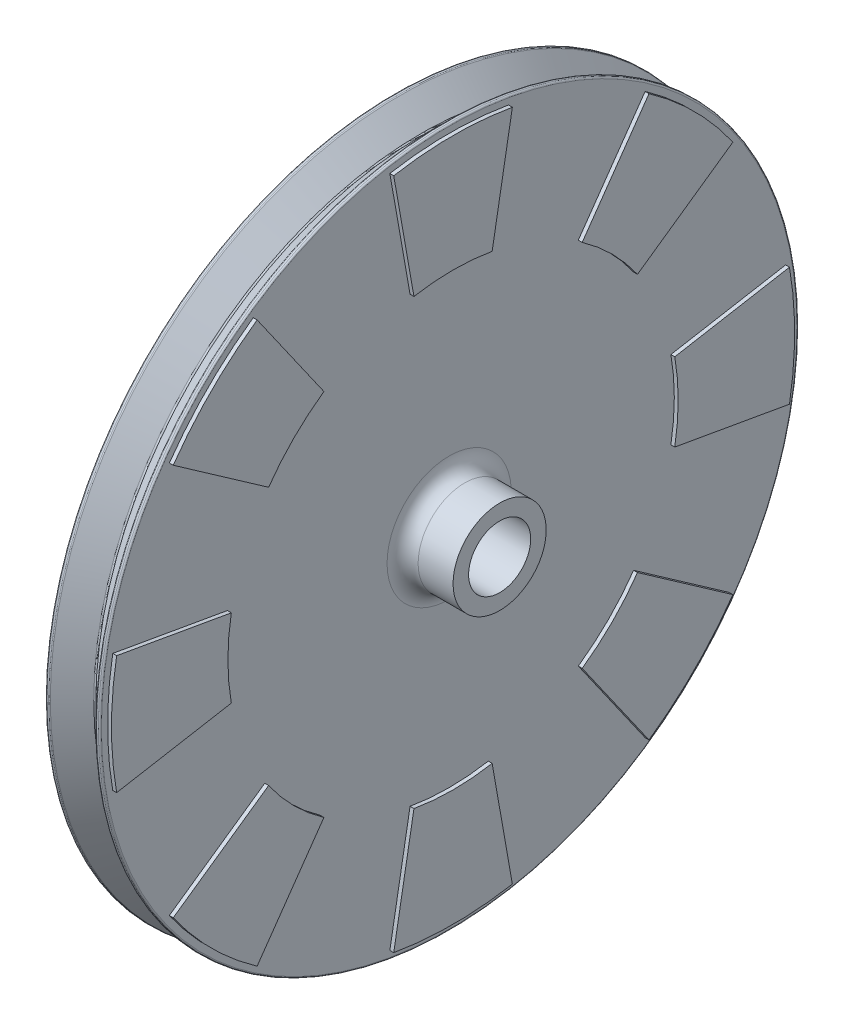
from build123d import *

# Parameters (mm, degrees)
EXTRUSION1_DEPTH             = 0.5
R_P_TITION_CIRCULAIRE1_COUNT = 8
CONG_1_R                     = 0.2
ESQUISSE3_R                  = 2.023797345
ENL_V_MAT_EXTRU_1_DEPTH      = 0.25


with BuildPart() as part:
    # Esquisse1 → Révolution2 (revolve)
    with BuildSketch(Plane.XY, mode=Mode.PRIVATE) as r_volution2_sk:
        with BuildLine():
            Line((-3, 45), (0, 42))
            Line((0, 42), (3, 45))
            Line((3, 45), (3.5, 45))
            Line((3.5, 45), (3.5, 8))
            ThreePointArc((3.5, 8), (4.085786438, 6.585786438), (5.5, 6))
            Line((5.5, 6), (10, 6))
            Line((10, 6), (10, 4))
            Line((10, 4), (0, 4))
            Line((0, 4), (0, 0))
            Line((0, 0), (-3.5, 0))
            Line((-3.5, 0), (-3.5, 45))
            Line((-3.5, 45), (-3, 45))
        make_face()
    revolve(r_volution2_sk.sketch.rotate(Axis((0, 0, 0), (1, 0, 0)), 90), axis=Axis((0, 0, 0), (1, 0, 0)))

    # Esquisse2 → Extrusion1 (add)
    with BuildSketch(Plane(origin=(3.5, 0, 0), x_dir=(0, 0, -1), z_dir=(1, 0, 0))):
        with BuildLine():
            Line((5.035797152, 28.559424837), (7.640519817, 43.331541133))
            ThreePointArc((7.640519817, 43.331541133), (0, 44), (-7.640519817, 43.331541133))
            Line((-7.640519817, 43.331541133), (-5.035797152, 28.559424837))
            ThreePointArc((-5.035797152, 28.559424837), (0, 29), (5.035797152, 28.559424837))
        make_face()
    extrusion1 = extrude(amount=EXTRUSION1_DEPTH)

    # Répétition circulaire1: Extrusion1 ×8 about axis
    r_p_tition_circulaire1_axis = Axis((0, 0, 0), (1, 0, 0))
    for i in range(1, R_P_TITION_CIRCULAIRE1_COUNT):
        add(extrusion1.rotate(r_p_tition_circulaire1_axis, i * 360 / R_P_TITION_CIRCULAIRE1_COUNT))

    # Congé1
    cong_1_edges = [part.edges().sort_by_distance(p)[0] for p in [
        (-3, 0, -45),
        (0, 0, -42),
        (-3.5, 0, -45),
        (3, 0, -45),
        (3.5, 0, -45),
    ]]
    fillet(cong_1_edges, radius=CONG_1_R)

    # Esquisse3 → Enlèv. mat.-Extru.1 (cut)
    with BuildSketch(Plane.ZY.offset(3.5)):
        with Locations((-32.017661382, 10.761647975)):
            Circle(ESQUISSE3_R)
    extrude(amount=-ENL_V_MAT_EXTRU_1_DEPTH, mode=Mode.SUBTRACT)


solid = part.part
